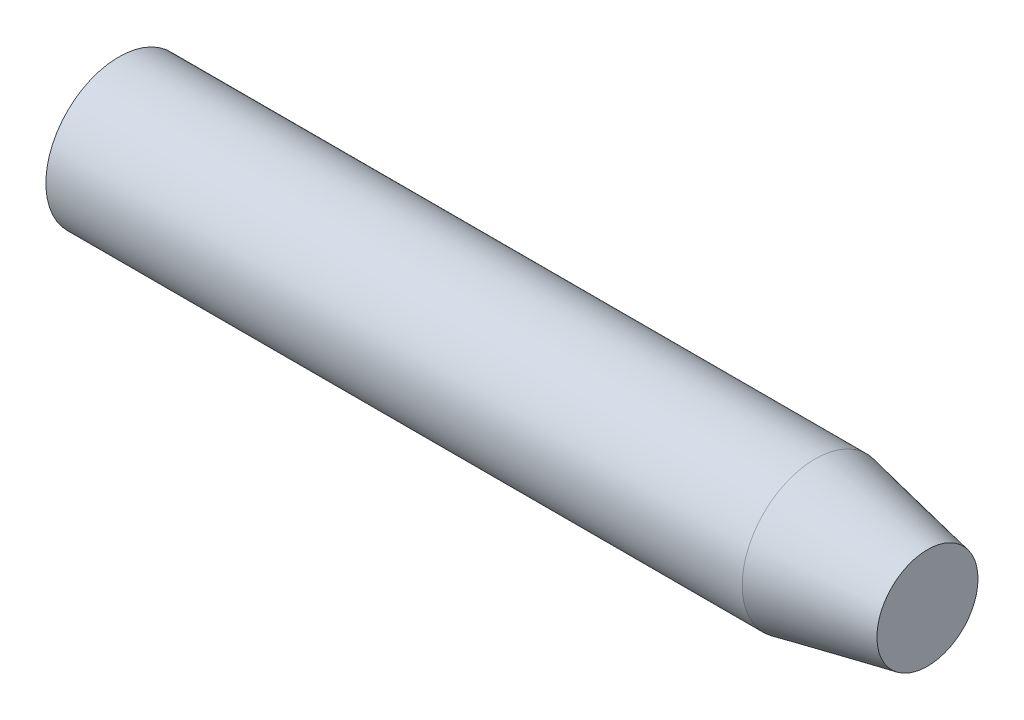
from build123d import *


with BuildPart() as part:
    # Sketch1 → Revolve1 (revolve)
    with BuildSketch(Plane.XY):
        Polygon((26, 6.5), (36, 4.5), (36, 0), (26, 0), (26, 4), (-36, 4), (-36, 6.5), align=None)
    revolve(axis=Axis((36, 0, 0), (-1, 0, 0)))


solid = part.part
